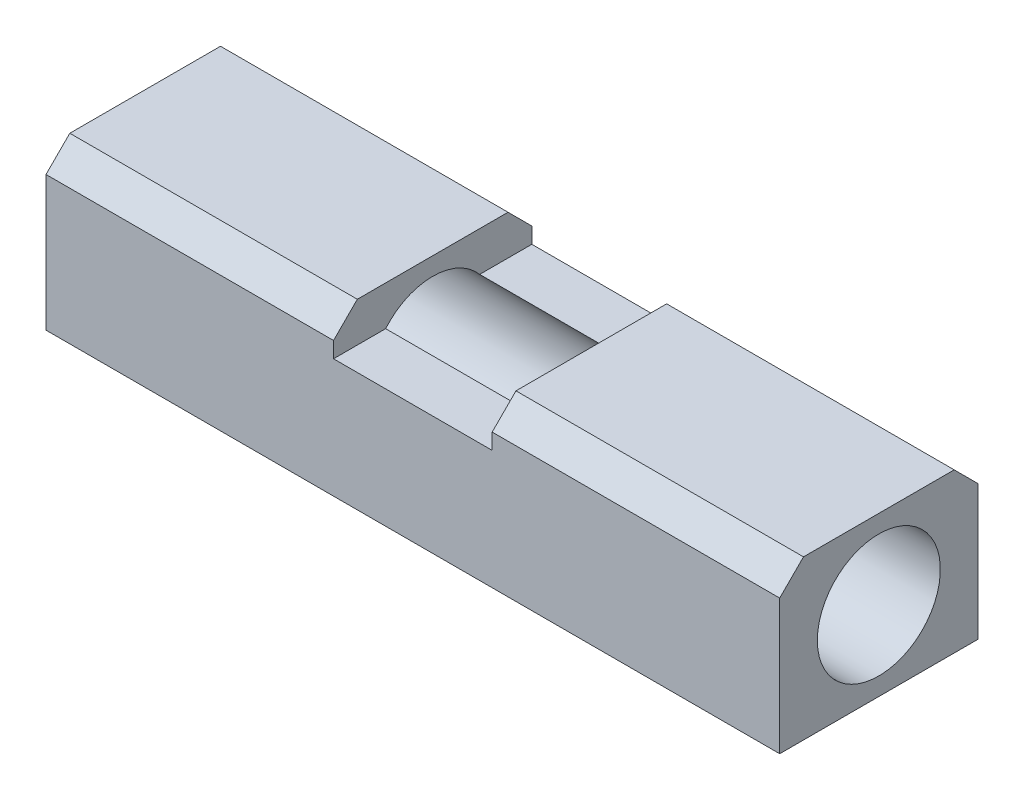
from build123d import *

# Parameters (mm, degrees)
ESQUISSE1_W             = 185
ESQUISSE1_H             = 40
BOSS_EXTRU_1_DEPTH      = 50
ESQUISSE2_R             = 15.509184
ENL_V_MAT_EXTRU_1_DEPTH = 185
CHANFREIN1_SIZE         = 6
ESQUISSE3_R             = 2
ENL_V_MAT_EXTRU_2_DEPTH = 15
ESQUISSE4_W             = 40
ESQUISSE4_H             = 10
ENL_V_MAT_EXTRU_3_DEPTH = 50


with BuildPart() as part:
    # Esquisse1 → Boss.-Extru.1 (new body)
    with BuildSketch(Plane.XY):
        with Locations((92.5, 20)):
            Rectangle(ESQUISSE1_W, ESQUISSE1_H)
    extrude(amount=BOSS_EXTRU_1_DEPTH)

    # Esquisse2 → Enlèv. mat.-Extru.1 (cut)
    with BuildSketch(Plane.ZY):
        with Locations((25, 20)):
            Circle(ESQUISSE2_R)
    extrude(amount=-ENL_V_MAT_EXTRU_1_DEPTH, mode=Mode.SUBTRACT)

    # Chanfrein1
    chanfrein1_edges = [part.edges().sort_by_distance(p)[0] for p in [
        (92.5, 40, 50),
        (92.5, 40, 0),
    ]]
    chamfer(chanfrein1_edges, length=CHANFREIN1_SIZE)

    # Esquisse3 → Enlèv. mat.-Extru.2 (cut)
    with BuildSketch(Plane.XZ):
        with Locations(Location((6, 44, 0), (0, 0, 270))):
            Circle(ESQUISSE3_R)
        with Locations(Location((6, 6, 0), (0, 0, 90))):
            Circle(ESQUISSE3_R)
        with Locations(Location((179, 6, 0), (0, 0, 270))):
            Circle(ESQUISSE3_R)
        with Locations(Location((179, 44, 0), (0, 0, 90))):
            Circle(ESQUISSE3_R)
    extrude(amount=-ENL_V_MAT_EXTRU_2_DEPTH, mode=Mode.SUBTRACT)

    # Esquisse4 → Enlèv. mat.-Extru.3 (cut)
    with BuildSketch(Plane.XY.offset(50)):
        with Locations((92.5, 35)):
            Rectangle(ESQUISSE4_W, ESQUISSE4_H)
    extrude(amount=-ENL_V_MAT_EXTRU_3_DEPTH, mode=Mode.SUBTRACT)


solid = part.part
